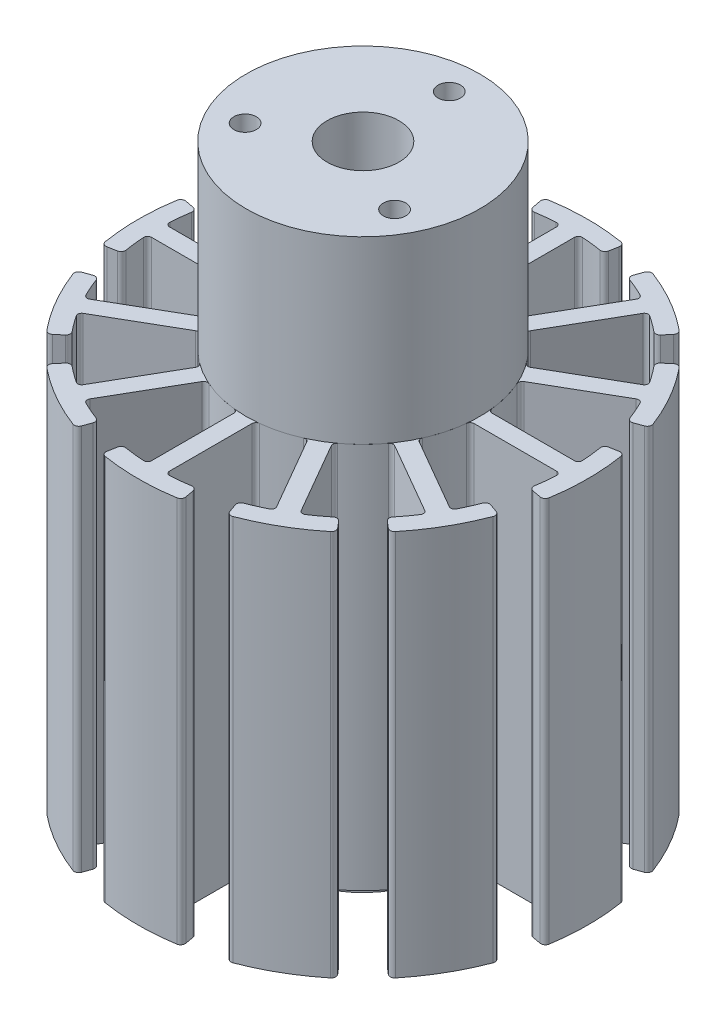
from build123d import *

# Parameters (mm, degrees)
SKETCH1_R           = 13
BOSS_EXTRUDE1_DEPTH = 20
SKETCH2_R           = 1.25
CUT_EXTRUDE1_DEPTH  = 5
SKETCH4_R           = 13
BOSS_EXTRUDE2_DEPTH = 43
SKETCH6_R           = 9
BOSS_EXTRUDE3_DEPTH = 3
SKETCH7_R           = 6
CUT_EXTRUDE2_DEPTH  = 3
SKETCH8_R           = 4
CUT_EXTRUDE3_DEPTH  = 73.242646685


with BuildPart() as part:
    # Sketch1 → Boss-Extrude1 (new body)
    with BuildSketch(Plane(origin=(0, 0, 0), x_dir=(1, 0, 0), z_dir=(0, 1, 0))):
        with Locations(Location((0, 0, 0), (0, 0, 270))):
            Circle(SKETCH1_R)
    extrude(amount=BOSS_EXTRUDE1_DEPTH)

    # Sketch2 → Cut-Extrude1 (cut)
    with BuildSketch(Plane(origin=(0, 20, 0), x_dir=(1, 0, 0), z_dir=(0, 1, 0))):
        with Locations(Location((0, 9.6, 0), (0, 0, 270))):
            Circle(SKETCH2_R)
        with Locations(Location((8.313843876, -4.8, 0), (0, 0, 270))):
            Circle(SKETCH2_R)
        with Locations(Location((-8.313843876, -4.8, 0), (0, 0, 270))):
            Circle(SKETCH2_R)
    extrude(amount=-CUT_EXTRUDE1_DEPTH, mode=Mode.SUBTRACT)


with BuildPart() as body_2:
    # Sketch4 → Boss-Extrude2 (new body)
    with BuildSketch(Plane.XZ):
        with BuildLine():
            ThreePointArc((1.393810622, 12.925064485), (1.112901285, 13.068912984), (1, 13.363625973))
            Line((1, 13.363625973), (1, 22.512818608))
            ThreePointArc((1, 22.512818608), (1.139323433, 22.834534733), (1.469282682, 22.953021771))
            ThreePointArc((1.469282682, 22.953021771), (2.557944672, 22.857316532), (3.640831488, 22.710005418))
            ThreePointArc((3.640831488, 22.710005418), (4.008783172, 22.795543465), (4.211879998, 23.114066429))
            Line((4.211879998, 23.114066429), (4.39118845, 24.09808009))
            ThreePointArc((4.39118845, 24.09808009), (4.307571564, 24.476340728), (3.978865765, 24.681341682))
            ThreePointArc((3.978865765, 24.681341682), (0, 25), (-3.978865765, 24.681341682))
            ThreePointArc((-3.978865765, 24.681341682), (-4.307571564, 24.476340728), (-4.39118845, 24.09808009))
            Line((-4.39118845, 24.09808009), (-4.211879998, 23.114066429))
            ThreePointArc((-4.211879998, 23.114066429), (-4.008783172, 22.795543465), (-3.640831488, 22.710005418))
            ThreePointArc((-3.640831488, 22.710005418), (-2.557944672, 22.857316532), (-1.469282682, 22.953021771))
            ThreePointArc((-1.469282682, 22.953021771), (-1.139323433, 22.834534733), (-1, 22.512818608))
            Line((-1, 22.512818608), (-1, 13.363625973))
            ThreePointArc((-1, 13.363625973), (-1.112901285, 13.068912984), (-1.393810622, 12.925064485))
            ThreePointArc((-1.393810622, 12.925064485), (0, 13), (1.393810622, 12.925064485))
        make_face()
        with Locations(Location((0, 0, 0), (0, 0, 90))):
            Circle(SKETCH4_R)
        with BuildLine():
            ThreePointArc((11.07323958, 7.54783839), (10.761560002, 7.498257276), (10.496528879, 7.669607649))
            ThreePointArc((10.496528879, 7.669607649), (11.258330249, 6.5), (11.890339501, 5.255456836))
            ThreePointArc((11.890339501, 5.255456836), (11.874461286, 5.570655707), (12.07323958, 5.815787583))
            Line((12.07323958, 5.815787583), (19.996672826, 10.3903839))
            ThreePointArc((19.996672826, 10.3903839), (20.344948879, 10.43058433), (20.612541288, 10.204074757))
            ThreePointArc((20.612541288, 10.204074757), (21.073989115, 9.213413199), (21.487857356, 8.20195015))
            ThreePointArc((21.487857356, 8.20195015), (21.74591132, 7.926063667), (22.123308711, 7.909438138))
            Line((22.123308711, 7.909438138), (23.065143765, 8.246159295))
            ThreePointArc((23.065143765, 8.246159295), (23.350918644, 8.50770396), (23.364101779, 8.89487201))
            ThreePointArc((23.364101779, 8.89487201), (21.650635095, 12.5), (19.385236014, 15.786469672))
            ThreePointArc((19.385236014, 15.786469672), (19.04334708, 15.968636767), (18.673955315, 15.851920795))
            Line((18.673955315, 15.851920795), (17.911428713, 15.204628291))
            ThreePointArc((17.911428713, 15.204628291), (17.737128148, 14.869479798), (17.847025868, 14.508055268))
            ThreePointArc((17.847025868, 14.508055268), (18.516044443, 13.643903333), (19.143258606, 12.748947013))
            ThreePointArc((19.143258606, 12.748947013), (19.205625446, 12.403950403), (18.996672826, 12.122434708))
            Line((18.996672826, 12.122434708), (11.07323958, 7.54783839))
        make_face()
        with BuildLine():
            ThreePointArc((13.363625973, 1), (13.068912984, 1.112901285), (12.925064485, 1.393810622))
            ThreePointArc((12.925064485, 1.393810622), (12.981252603, 0.697911775), (13, 0))
            ThreePointArc((13, 0), (12.981252603, -0.697911775), (12.925064485, -1.393810622))
            ThreePointArc((12.925064485, -1.393810622), (13.068912984, -1.112901285), (13.363625973, -1))
            Line((13.363625973, -1), (22.512818608, -1))
            ThreePointArc((22.512818608, -1), (22.834534733, -1.139323433), (22.953021771, -1.469282682))
            ThreePointArc((22.953021771, -1.469282682), (22.857316532, -2.557944672), (22.710005418, -3.640831488))
            ThreePointArc((22.710005418, -3.640831488), (22.795543465, -4.008783172), (23.114066429, -4.211879998))
            Line((23.114066429, -4.211879998), (24.09808009, -4.39118845))
            ThreePointArc((24.09808009, -4.39118845), (24.476340728, -4.307571564), (24.681341682, -3.978865765))
            ThreePointArc((24.681341682, -3.978865765), (25, 0), (24.681341682, 3.978865765))
            ThreePointArc((24.681341682, 3.978865765), (24.476340728, 4.307571564), (24.09808009, 4.39118845))
            Line((24.09808009, 4.39118845), (23.114066429, 4.211879998))
            ThreePointArc((23.114066429, 4.211879998), (22.795543465, 4.008783172), (22.710005418, 3.640831488))
            ThreePointArc((22.710005418, 3.640831488), (22.857316532, 2.557944672), (22.953021771, 1.469282682))
            ThreePointArc((22.953021771, 1.469282682), (22.834534733, 1.139323433), (22.512818608, 1))
            Line((22.512818608, 1), (13.363625973, 1))
        make_face()
        with BuildLine():
            ThreePointArc((5.815787583, 12.07323958), (5.570655707, 11.874461286), (5.255456836, 11.890339501))
            ThreePointArc((5.255456836, 11.890339501), (6.5, 11.258330249), (7.669607649, 10.496528879))
            ThreePointArc((7.669607649, 10.496528879), (7.498257276, 10.761560002), (7.54783839, 11.07323958))
            Line((7.54783839, 11.07323958), (12.122434708, 18.996672826))
            ThreePointArc((12.122434708, 18.996672826), (12.403950403, 19.205625446), (12.748947013, 19.143258606))
            ThreePointArc((12.748947013, 19.143258606), (13.643903333, 18.516044443), (14.508055268, 17.847025868))
            ThreePointArc((14.508055268, 17.847025868), (14.869479798, 17.737128148), (15.204628291, 17.911428713))
            Line((15.204628291, 17.911428713), (15.851920795, 18.673955315))
            ThreePointArc((15.851920795, 18.673955315), (15.968636767, 19.04334708), (15.786469672, 19.385236014))
            ThreePointArc((15.786469672, 19.385236014), (14.188520003, 20.58363185), (12.5, 21.650635095))
            ThreePointArc((12.5, 21.650635095), (10.731688083, 22.579434689), (8.89487201, 23.364101779))
            ThreePointArc((8.89487201, 23.364101779), (8.50770396, 23.350918644), (8.246159295, 23.065143765))
            Line((8.246159295, 23.065143765), (7.909438138, 22.123308711))
            ThreePointArc((7.909438138, 22.123308711), (7.926063667, 21.74591132), (8.20195015, 21.487857356))
            ThreePointArc((8.20195015, 21.487857356), (9.213413199, 21.073989115), (10.204074757, 20.612541288))
            ThreePointArc((10.204074757, 20.612541288), (10.43058433, 20.344948879), (10.3903839, 19.996672826))
            Line((10.3903839, 19.996672826), (5.815787583, 12.07323958))
        make_face()
        with BuildLine():
            ThreePointArc((-7.669607649, 10.496528879), (-6.5, 11.258330249), (-5.255456836, 11.890339501))
            ThreePointArc((-5.255456836, 11.890339501), (-5.570655707, 11.874461286), (-5.815787583, 12.07323958))
            Line((-5.815787583, 12.07323958), (-10.3903839, 19.996672826))
            ThreePointArc((-10.3903839, 19.996672826), (-10.43058433, 20.344948879), (-10.204074757, 20.612541288))
            ThreePointArc((-10.204074757, 20.612541288), (-9.213413199, 21.073989115), (-8.20195015, 21.487857356))
            ThreePointArc((-8.20195015, 21.487857356), (-7.926063667, 21.74591132), (-7.909438138, 22.123308711))
            Line((-7.909438138, 22.123308711), (-8.246159295, 23.065143765))
            ThreePointArc((-8.246159295, 23.065143765), (-8.50770396, 23.350918644), (-8.89487201, 23.364101779))
            ThreePointArc((-8.89487201, 23.364101779), (-10.731688083, 22.579434689), (-12.5, 21.650635095))
            ThreePointArc((-12.5, 21.650635095), (-14.188520003, 20.58363185), (-15.786469672, 19.385236014))
            ThreePointArc((-15.786469672, 19.385236014), (-15.968636767, 19.04334708), (-15.851920795, 18.673955315))
            Line((-15.851920795, 18.673955315), (-15.204628291, 17.911428713))
            ThreePointArc((-15.204628291, 17.911428713), (-14.869479798, 17.737128148), (-14.508055268, 17.847025868))
            ThreePointArc((-14.508055268, 17.847025868), (-13.643903333, 18.516044443), (-12.748947013, 19.143258606))
            ThreePointArc((-12.748947013, 19.143258606), (-12.403950403, 19.205625446), (-12.122434708, 18.996672826))
            Line((-12.122434708, 18.996672826), (-7.54783839, 11.07323958))
            ThreePointArc((-7.54783839, 11.07323958), (-7.498257276, 10.761560002), (-7.669607649, 10.496528879))
        make_face()
        with BuildLine():
            ThreePointArc((-11.890339501, 5.255456836), (-11.258330249, 6.5), (-10.496528879, 7.669607649))
            ThreePointArc((-10.496528879, 7.669607649), (-10.761560002, 7.498257276), (-11.07323958, 7.54783839))
            Line((-11.07323958, 7.54783839), (-18.996672826, 12.122434708))
            ThreePointArc((-18.996672826, 12.122434708), (-19.205625446, 12.403950403), (-19.143258606, 12.748947013))
            ThreePointArc((-19.143258606, 12.748947013), (-18.516044443, 13.643903333), (-17.847025868, 14.508055268))
            ThreePointArc((-17.847025868, 14.508055268), (-17.737128148, 14.869479798), (-17.911428713, 15.204628291))
            Line((-17.911428713, 15.204628291), (-18.673955315, 15.851920795))
            ThreePointArc((-18.673955315, 15.851920795), (-19.04334708, 15.968636767), (-19.385236014, 15.786469672))
            ThreePointArc((-19.385236014, 15.786469672), (-21.650635095, 12.5), (-23.364101779, 8.89487201))
            ThreePointArc((-23.364101779, 8.89487201), (-23.350918644, 8.50770396), (-23.065143765, 8.246159295))
            Line((-23.065143765, 8.246159295), (-22.123308711, 7.909438138))
            ThreePointArc((-22.123308711, 7.909438138), (-21.74591132, 7.926063667), (-21.487857356, 8.20195015))
            ThreePointArc((-21.487857356, 8.20195015), (-21.073989115, 9.213413199), (-20.612541288, 10.204074757))
            ThreePointArc((-20.612541288, 10.204074757), (-20.344948879, 10.43058433), (-19.996672826, 10.3903839))
            Line((-19.996672826, 10.3903839), (-12.07323958, 5.815787583))
            ThreePointArc((-12.07323958, 5.815787583), (-11.874461286, 5.570655707), (-11.890339501, 5.255456836))
        make_face()
        with BuildLine():
            ThreePointArc((-12.925064485, -1.393810622), (-13, 0), (-12.925064485, 1.393810622))
            ThreePointArc((-12.925064485, 1.393810622), (-13.068912984, 1.112901285), (-13.363625973, 1))
            Line((-13.363625973, 1), (-22.512818608, 1))
            ThreePointArc((-22.512818608, 1), (-22.834534733, 1.139323433), (-22.953021771, 1.469282682))
            ThreePointArc((-22.953021771, 1.469282682), (-22.857316532, 2.557944672), (-22.710005418, 3.640831488))
            ThreePointArc((-22.710005418, 3.640831488), (-22.795543465, 4.008783172), (-23.114066429, 4.211879998))
            Line((-23.114066429, 4.211879998), (-24.09808009, 4.39118845))
            ThreePointArc((-24.09808009, 4.39118845), (-24.476340728, 4.307571564), (-24.681341682, 3.978865765))
            ThreePointArc((-24.681341682, 3.978865765), (-25, 0), (-24.681341682, -3.978865765))
            ThreePointArc((-24.681341682, -3.978865765), (-24.476340728, -4.307571564), (-24.09808009, -4.39118845))
            Line((-24.09808009, -4.39118845), (-23.114066429, -4.211879998))
            ThreePointArc((-23.114066429, -4.211879998), (-22.795543465, -4.008783172), (-22.710005418, -3.640831488))
            ThreePointArc((-22.710005418, -3.640831488), (-22.857316532, -2.557944672), (-22.953021771, -1.469282682))
            ThreePointArc((-22.953021771, -1.469282682), (-22.834534733, -1.139323433), (-22.512818608, -1))
            Line((-22.512818608, -1), (-13.363625973, -1))
            ThreePointArc((-13.363625973, -1), (-13.068912984, -1.112901285), (-12.925064485, -1.393810622))
        make_face()
        with BuildLine():
            ThreePointArc((-10.496528879, -7.669607649), (-11.258330249, -6.5), (-11.890339501, -5.255456836))
            ThreePointArc((-11.890339501, -5.255456836), (-11.874461286, -5.570655707), (-12.07323958, -5.815787583))
            Line((-12.07323958, -5.815787583), (-19.996672826, -10.3903839))
            ThreePointArc((-19.996672826, -10.3903839), (-20.344948879, -10.43058433), (-20.612541288, -10.204074757))
            ThreePointArc((-20.612541288, -10.204074757), (-21.073989115, -9.213413199), (-21.487857356, -8.20195015))
            ThreePointArc((-21.487857356, -8.20195015), (-21.74591132, -7.926063667), (-22.123308711, -7.909438138))
            Line((-22.123308711, -7.909438138), (-23.065143765, -8.246159295))
            ThreePointArc((-23.065143765, -8.246159295), (-23.350918644, -8.50770396), (-23.364101779, -8.89487201))
            ThreePointArc((-23.364101779, -8.89487201), (-21.650635095, -12.5), (-19.385236014, -15.786469672))
            ThreePointArc((-19.385236014, -15.786469672), (-19.04334708, -15.968636767), (-18.673955315, -15.851920795))
            Line((-18.673955315, -15.851920795), (-17.911428713, -15.204628291))
            ThreePointArc((-17.911428713, -15.204628291), (-17.737128148, -14.869479798), (-17.847025868, -14.508055268))
            ThreePointArc((-17.847025868, -14.508055268), (-18.516044443, -13.643903333), (-19.143258606, -12.748947013))
            ThreePointArc((-19.143258606, -12.748947013), (-19.205625446, -12.403950403), (-18.996672826, -12.122434708))
            Line((-18.996672826, -12.122434708), (-11.07323958, -7.54783839))
            ThreePointArc((-11.07323958, -7.54783839), (-10.761560002, -7.498257276), (-10.496528879, -7.669607649))
        make_face()
        with BuildLine():
            ThreePointArc((-5.255456836, -11.890339501), (-6.5, -11.258330249), (-7.669607649, -10.496528879))
            ThreePointArc((-7.669607649, -10.496528879), (-7.498257276, -10.761560002), (-7.54783839, -11.07323958))
            Line((-7.54783839, -11.07323958), (-12.122434708, -18.996672826))
            ThreePointArc((-12.122434708, -18.996672826), (-12.403950403, -19.205625446), (-12.748947013, -19.143258606))
            ThreePointArc((-12.748947013, -19.143258606), (-13.643903333, -18.516044443), (-14.508055268, -17.847025868))
            ThreePointArc((-14.508055268, -17.847025868), (-14.869479798, -17.737128148), (-15.204628291, -17.911428713))
            Line((-15.204628291, -17.911428713), (-15.851920795, -18.673955315))
            ThreePointArc((-15.851920795, -18.673955315), (-15.968636767, -19.04334708), (-15.786469672, -19.385236014))
            ThreePointArc((-15.786469672, -19.385236014), (-12.5, -21.650635095), (-8.89487201, -23.364101779))
            ThreePointArc((-8.89487201, -23.364101779), (-8.50770396, -23.350918644), (-8.246159295, -23.065143765))
            Line((-8.246159295, -23.065143765), (-7.909438138, -22.123308711))
            ThreePointArc((-7.909438138, -22.123308711), (-7.926063667, -21.74591132), (-8.20195015, -21.487857356))
            ThreePointArc((-8.20195015, -21.487857356), (-9.213413199, -21.073989115), (-10.204074757, -20.612541288))
            ThreePointArc((-10.204074757, -20.612541288), (-10.43058433, -20.344948879), (-10.3903839, -19.996672826))
            Line((-10.3903839, -19.996672826), (-5.815787583, -12.07323958))
            ThreePointArc((-5.815787583, -12.07323958), (-5.570655707, -11.874461286), (-5.255456836, -11.890339501))
        make_face()
        with BuildLine():
            ThreePointArc((7.54783839, -11.07323958), (7.498257276, -10.761560002), (7.669607649, -10.496528879))
            ThreePointArc((7.669607649, -10.496528879), (6.5, -11.258330249), (5.255456836, -11.890339501))
            ThreePointArc((5.255456836, -11.890339501), (5.570655707, -11.874461286), (5.815787583, -12.07323958))
            Line((5.815787583, -12.07323958), (10.3903839, -19.996672826))
            ThreePointArc((10.3903839, -19.996672826), (10.43058433, -20.344948879), (10.204074757, -20.612541288))
            ThreePointArc((10.204074757, -20.612541288), (9.213413199, -21.073989115), (8.20195015, -21.487857356))
            ThreePointArc((8.20195015, -21.487857356), (7.926063667, -21.74591132), (7.909438138, -22.123308711))
            Line((7.909438138, -22.123308711), (8.246159295, -23.065143765))
            ThreePointArc((8.246159295, -23.065143765), (8.50770396, -23.350918644), (8.89487201, -23.364101779))
            ThreePointArc((8.89487201, -23.364101779), (12.5, -21.650635095), (15.786469672, -19.385236014))
            ThreePointArc((15.786469672, -19.385236014), (15.968636767, -19.04334708), (15.851920795, -18.673955315))
            Line((15.851920795, -18.673955315), (15.204628291, -17.911428713))
            ThreePointArc((15.204628291, -17.911428713), (14.869479798, -17.737128148), (14.508055268, -17.847025868))
            ThreePointArc((14.508055268, -17.847025868), (13.643903333, -18.516044443), (12.748947013, -19.143258606))
            ThreePointArc((12.748947013, -19.143258606), (12.403950403, -19.205625446), (12.122434708, -18.996672826))
            Line((12.122434708, -18.996672826), (7.54783839, -11.07323958))
        make_face()
        with BuildLine():
            ThreePointArc((1, -13.363625973), (1.112901285, -13.068912984), (1.393810622, -12.925064485))
            ThreePointArc((1.393810622, -12.925064485), (0, -13), (-1.393810622, -12.925064485))
            ThreePointArc((-1.393810622, -12.925064485), (-1.112901285, -13.068912984), (-1, -13.363625973))
            Line((-1, -13.363625973), (-1, -22.512818608))
            ThreePointArc((-1, -22.512818608), (-1.139323433, -22.834534733), (-1.469282682, -22.953021771))
            ThreePointArc((-1.469282682, -22.953021771), (-2.557944672, -22.857316532), (-3.640831488, -22.710005418))
            ThreePointArc((-3.640831488, -22.710005418), (-4.008783172, -22.795543465), (-4.211879998, -23.114066429))
            Line((-4.211879998, -23.114066429), (-4.39118845, -24.09808009))
            ThreePointArc((-4.39118845, -24.09808009), (-4.307571564, -24.476340728), (-3.978865765, -24.681341682))
            ThreePointArc((-3.978865765, -24.681341682), (0, -25), (3.978865765, -24.681341682))
            ThreePointArc((3.978865765, -24.681341682), (4.307571564, -24.476340728), (4.39118845, -24.09808009))
            Line((4.39118845, -24.09808009), (4.211879998, -23.114066429))
            ThreePointArc((4.211879998, -23.114066429), (4.008783172, -22.795543465), (3.640831488, -22.710005418))
            ThreePointArc((3.640831488, -22.710005418), (2.557944672, -22.857316532), (1.469282682, -22.953021771))
            ThreePointArc((1.469282682, -22.953021771), (1.139323433, -22.834534733), (1, -22.512818608))
            Line((1, -22.512818608), (1, -13.363625973))
        make_face()
        with BuildLine():
            ThreePointArc((12.07323958, -5.815787583), (11.874461286, -5.570655707), (11.890339501, -5.255456836))
            ThreePointArc((11.890339501, -5.255456836), (11.258330249, -6.5), (10.496528879, -7.669607649))
            ThreePointArc((10.496528879, -7.669607649), (10.761560002, -7.498257276), (11.07323958, -7.54783839))
            Line((11.07323958, -7.54783839), (18.996672826, -12.122434708))
            ThreePointArc((18.996672826, -12.122434708), (19.205625446, -12.403950403), (19.143258606, -12.748947013))
            ThreePointArc((19.143258606, -12.748947013), (18.516044443, -13.643903333), (17.847025868, -14.508055268))
            ThreePointArc((17.847025868, -14.508055268), (17.737128148, -14.869479798), (17.911428713, -15.204628291))
            Line((17.911428713, -15.204628291), (18.673955315, -15.851920795))
            ThreePointArc((18.673955315, -15.851920795), (19.04334708, -15.968636767), (19.385236014, -15.786469672))
            ThreePointArc((19.385236014, -15.786469672), (21.650635095, -12.5), (23.364101779, -8.89487201))
            ThreePointArc((23.364101779, -8.89487201), (23.350918644, -8.50770396), (23.065143765, -8.246159295))
            Line((23.065143765, -8.246159295), (22.123308711, -7.909438138))
            ThreePointArc((22.123308711, -7.909438138), (21.74591132, -7.926063667), (21.487857356, -8.20195015))
            ThreePointArc((21.487857356, -8.20195015), (21.073989115, -9.213413199), (20.612541288, -10.204074757))
            ThreePointArc((20.612541288, -10.204074757), (20.344948879, -10.43058433), (19.996672826, -10.3903839))
            Line((19.996672826, -10.3903839), (12.07323958, -5.815787583))
        make_face()
    extrude(amount=BOSS_EXTRUDE2_DEPTH)

    # Sketch6 → Boss-Extrude3 (add)
    with BuildSketch(Plane(origin=(0, -43, 0), x_dir=(-1, 0, 0), z_dir=(0, -1, 0))):
        with Locations(Location((0, 0, 0), (0, 0, 90))):
            Circle(SKETCH6_R)
    extrude(amount=BOSS_EXTRUDE3_DEPTH)

    # Sketch7 → Cut-Extrude2 (cut)
    with BuildSketch(Plane(origin=(0, -46, 0), x_dir=(-1, 0, 0), z_dir=(0, -1, 0))):
        with Locations(Location((0, 0, 0), (0, 0, 90))):
            Circle(SKETCH7_R)
    extrude(amount=-CUT_EXTRUDE2_DEPTH, mode=Mode.SUBTRACT)


with BuildPart() as cut_extrude3_tool:
    # Sketch8 → Cut-Extrude3 (new, through all)
    with BuildSketch(Plane(origin=(0, -43, 0), x_dir=(-1, 0, 0), z_dir=(0, -1, 0))):
        with Locations(Location((0, 0, 0), (0, 0, 90))):
            Circle(SKETCH8_R)
    extrude(amount=-CUT_EXTRUDE3_DEPTH)


with BuildPart() as part_1:
    add(part.part)

    # Cut-Extrude3: cut by cut_extrude3_tool
    add(cut_extrude3_tool.part, mode=Mode.SUBTRACT)


with BuildPart() as body_2_1:
    add(body_2.part)

    # Cut-Extrude3: cut by cut_extrude3_tool
    add(cut_extrude3_tool.part, mode=Mode.SUBTRACT)


solid = Compound([part_1.part, body_2_1.part])
